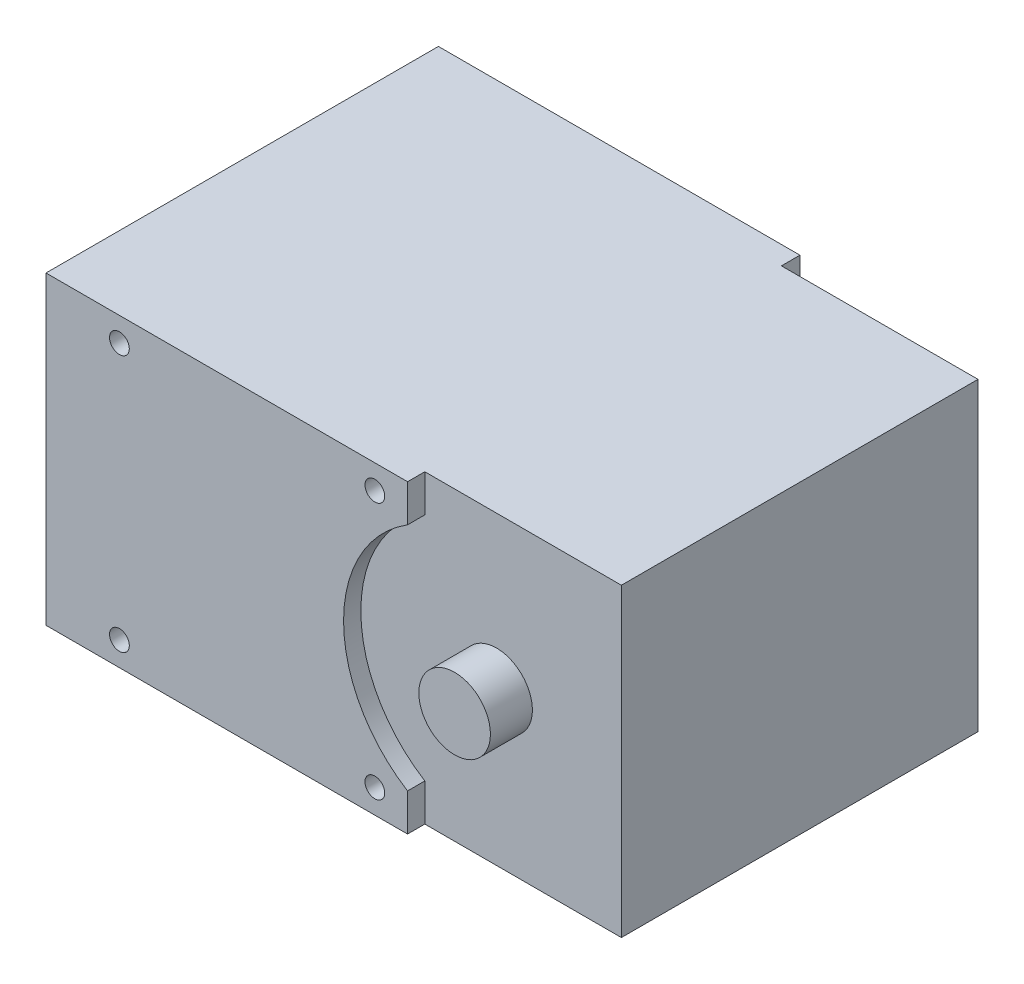
from build123d import *

# Parameters (mm, degrees)
SKETCH_1_W            = 45.23
SKETCH_1_H            = 24.73
EXTRUDE_1_DEPTH       = 28.9
SKETCH_2_R            = 2.9
EXTRUDE_2_DEPTH       = 3.4
EXTRUDE_3_DEPTH       = 1.4
SKETCH_4_R            = 0.8
CUT_EXTRUDE_1_DEPTH   = 5
SKETCH_6_R            = 0.8
CUT_EXTRUDE_2_DEPTH   = 4.1
EXTRUDE_START         = 1.5
SKETCH_7_R            = 0.8
EXTRUDE_5_DEPTH       = 1.5
EXTRUDE_6_DEPTH       = 24.73
EXTRUDE_START_2       = 3.5
SKETCH_5_R            = 2.9
EXTRUDE_4_DEPTH       = 3.5
SKETCH_11_W           = 39.736399629
SKETCH_11_H           = 38.5
SKETCH_11_W_2         = 19.736399629
SKETCH_11_H_2         = 18.5
CUT_EXTRUDE_1_2_DEPTH = 62.642240388


with BuildPart() as part:
    # 草图1 → 凸台-拉伸1 (new body)
    with BuildSketch(Plane.XY):
        with Locations((22.615, 12.365)):
            Rectangle(SKETCH_1_W, SKETCH_1_H)
    extrude(amount=EXTRUDE_1_DEPTH)

    # 草图2 → 凸台-拉伸2 (add)
    with BuildSketch(Plane.XY.offset(28.9)):
        with Locations(Location((35.115, 12.365, 0), (0, 0, 180))):
            Circle(SKETCH_2_R)
    extrude(amount=EXTRUDE_2_DEPTH)

    # 草图3 → 凸台-拉伸3 (add)
    with BuildSketch(Plane.XY.offset(28.9)):
        with BuildLine():
            Line((29.3, 21.702332328), (29.3, 24.73))
            Line((29.3, 24.73), (0, 24.73))
            Line((0, 24.73), (0, 0))
            Line((0, 0), (29.3, 0))
            Line((29.3, 0), (29.3, 3.027667672))
            ThreePointArc((29.3, 3.027667672), (24.115, 12.365), (29.3, 21.702332328))
        make_face()
    extrude(amount=EXTRUDE_3_DEPTH)

    # 草图4 → Cut-Extrude 1 (cut)
    with BuildSketch(Plane.XY.offset(30.3)):
        with Locations((5.95, 22.78)):
            Circle(SKETCH_4_R)
        with Locations((26.65, 22.78)):
            Circle(SKETCH_4_R)
        with Locations(Location((26.65, 1.95, 0), (0, 0, 180))):
            Circle(SKETCH_4_R)
        with Locations(Location((5.95, 1.95, 0), (0, 0, 180))):
            Circle(SKETCH_4_R)
    extrude(amount=-CUT_EXTRUDE_1_DEPTH, mode=Mode.SUBTRACT)

    # 草图6 → 切除-拉伸2 (cut)
    with BuildSketch(Plane(origin=(0, 0, 0), x_dir=(-1, 0, 0), z_dir=(0, 0, -1))):
        with Locations((-26.71, 22.615)):
            Circle(SKETCH_6_R)
        with Locations((-2.27, 22.615)):
            Circle(SKETCH_6_R)
        with Locations((-2.27, 2.115)):
            Circle(SKETCH_6_R)
        with Locations((-26.71, 2.115)):
            Circle(SKETCH_6_R)
    extrude(amount=-CUT_EXTRUDE_2_DEPTH, mode=Mode.SUBTRACT)

    # 草图7 → 凸台-拉伸5 (add)
    with BuildSketch(Plane(origin=(0, 0, 0), x_dir=(-1, 0, 0), z_dir=(0, 0, -1)).offset(EXTRUDE_START)):
        with BuildLine():
            Line((0, 24.73), (-29.3, 24.73))
            Line((-29.3, 24.73), (-29.3, 21.702332328))
            ThreePointArc((-29.3, 21.702332328), (-24.115, 12.365), (-29.3, 3.027667672))
            Line((-29.3, 3.027667672), (-29.3, 0))
            Line((-29.3, 0), (0, 0))
            Line((0, 0), (0, 24.73))
        make_face()
        with Locations((-26.71, 2.115)):
            Circle(SKETCH_7_R, mode=Mode.SUBTRACT)
        with Locations((-2.27, 2.115)):
            Circle(SKETCH_7_R, mode=Mode.SUBTRACT)
        with Locations((-26.71, 22.615)):
            Circle(SKETCH_7_R, mode=Mode.SUBTRACT)
        with Locations((-2.27, 22.615)):
            Circle(SKETCH_7_R, mode=Mode.SUBTRACT)
    extrude(amount=-EXTRUDE_5_DEPTH)

    # 草图10 → 凸台-拉伸6 (add, through all)
    with BuildSketch(Plane(origin=(0, 0, 0), x_dir=(1, 0, 0), z_dir=(0, 1, 0))):
        Polygon((5.2, 1.5), (5.2, 3.5), (16.6, 3.5), (18.6, 1.5), align=None)
    extrude(amount=EXTRUDE_6_DEPTH)

    # 草图5 → 凸台-拉伸4 (add)
    with BuildSketch(Plane(origin=(0, 0, 0), x_dir=(-1, 0, 0), z_dir=(0, 0, -1)).offset(EXTRUDE_START_2)):
        with Locations((-35.115, 12.365)):
            Circle(SKETCH_5_R)
    extrude(amount=-EXTRUDE_4_DEPTH)

    # 草图11 → Cut-Extrude 1 2 (cut, through all)
    with BuildSketch(Plane(origin=(0, 0, -1.5), x_dir=(-1, 0, 0), z_dir=(0, 0, -1))):
        with Locations((-9.868199815, 12.365)):
            Rectangle(SKETCH_11_W, SKETCH_11_H)
        with Locations((-9.868199815, 12.365)):
            Rectangle(SKETCH_11_W_2, SKETCH_11_H_2, mode=Mode.SUBTRACT)
    extrude(amount=CUT_EXTRUDE_1_2_DEPTH, mode=Mode.SUBTRACT)


solid = part.part
